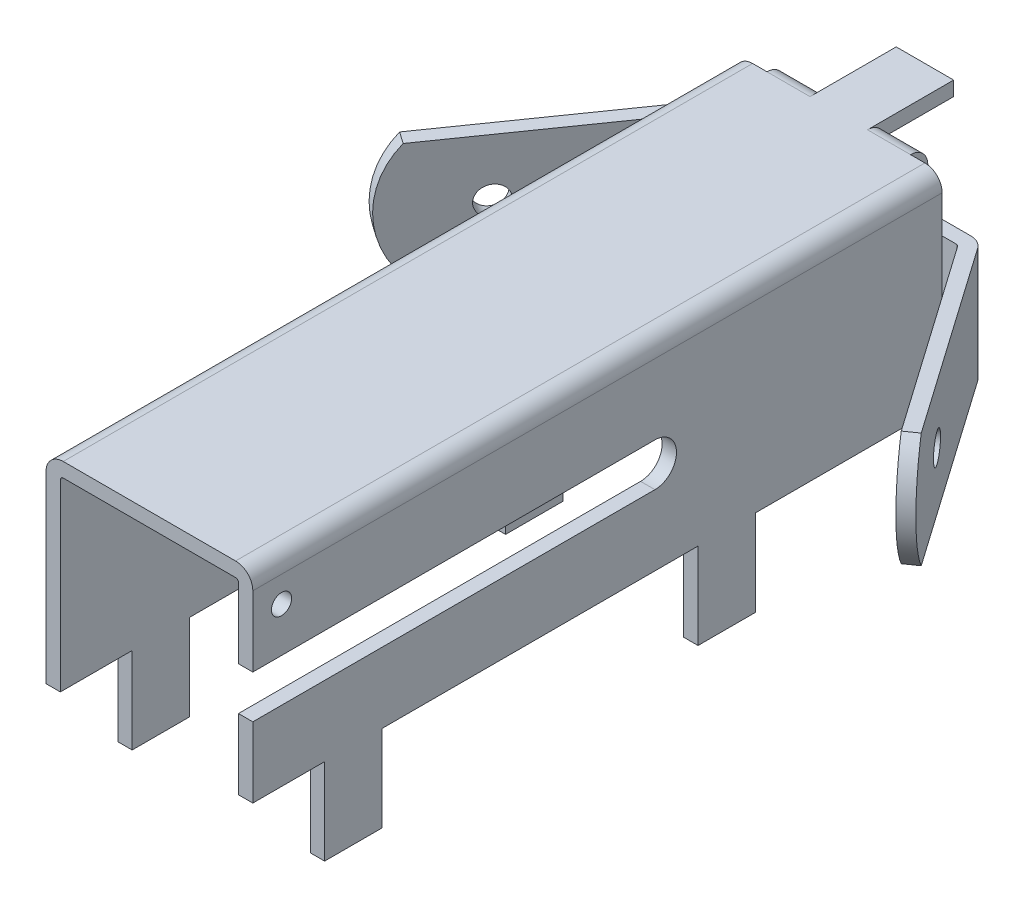
from build123d import *

# Parameters (mm, degrees)
BOSS_EXTRU_1_DEPTH      = 24
ESQUISSE2_W             = 2
ESQUISSE2_H             = 0.5
BOSS_EXTRU_2_DEPTH      = 3
BOSS_EXTRU_3_DEPTH      = 3
ESQUISSE6_W             = 0.6
ESQUISSE6_H             = 2
ENL_V_MAT_EXTRU_1_DEPTH = 1.5
BOSS_EXTRU_4_DEPTH      = 4
ENL_V_MAT_EXTRU_3_REACH = 29.975
ESQUISSE8_R             = 0.5
ESQUISSE9_W             = 0.5
ESQUISSE9_H             = 2
BOSS_EXTRU_5_DEPTH      = 3
ENL_V_MAT_EXTRU_2_REACH = 30.233
ESQUISSE7_R             = 0.35


with BuildPart() as part:
    # Esquisse1 → Boss.-Extru.1 (new body)
    with BuildSketch(Plane.XY):
        with BuildLine():
            Line((-3, 7), (3, 7))
            ThreePointArc((3, 7), (3.424264069, 6.824264069), (3.6, 6.4))
            Line((3.6, 6.4), (3.6, 0))
            Line((3.6, 0), (3.1, 0))
            Line((3.1, 0), (3.1, 6.4))
            ThreePointArc((3.1, 6.4), (3.070710678, 6.470710678), (3, 6.5))
            Line((3, 6.5), (-3, 6.5))
            ThreePointArc((-3, 6.5), (-3.070710678, 6.470710678), (-3.1, 6.4))
            Line((-3.1, 6.4), (-3.1, 0))
            Line((-3.1, 0), (-3.6, 0))
            Line((-3.6, 0), (-3.6, 6.4))
            ThreePointArc((-3.6, 6.4), (-3.424264069, 6.824264069), (-3, 7))
        make_face()
    extrude(amount=BOSS_EXTRU_1_DEPTH)

    # Esquisse2 → Boss.-Extru.2 (add)
    with BuildSketch(Plane(origin=(0, 0, 0), x_dir=(-1, 0, 0), z_dir=(0, 0, -1))):
        with Locations((0, 6.75)):
            Rectangle(ESQUISSE2_W, ESQUISSE2_H)
    extrude(amount=BOSS_EXTRU_2_DEPTH)

    # Esquisse5 → Boss.-Extru.3 (add)
    with BuildSketch(Plane.ZY.offset(1)):
        with BuildLine():
            Line((-0.1, 1), (-0.6, 1))
            Line((-0.6, 1), (-0.6, 6.4))
            ThreePointArc((-0.6, 6.4), (-0.424264069, 6.824264069), (0, 7))
            Line((0, 7), (0, 6.5))
            ThreePointArc((0, 6.5), (-0.070710678, 6.470710678), (-0.1, 6.4))
            Line((-0.1, 6.4), (-0.1, 1))
        make_face()
    boss_extru_3 = extrude(amount=BOSS_EXTRU_3_DEPTH)

    # Esquisse6 → Enlèv. mat.-Extru.1 (cut)
    with BuildSketch(Plane.ZY.offset(4)):
        with Locations((-0.3, 6)):
            Rectangle(ESQUISSE6_W, ESQUISSE6_H)
    enl_v_mat_extru_1 = extrude(amount=-ENL_V_MAT_EXTRU_1_DEPTH, mode=Mode.SUBTRACT)

    # Esquisse3 → Boss.-Extru.4 (add)
    with BuildSketch(Plane(origin=(0, 5, 0), x_dir=(1, 0, 0), z_dir=(0, 1, 0))):
        with BuildLine():
            Line((-4.491491227, 0.344145862), (-9.653679154, -7.028222537))
            Line((-9.653679154, -7.028222537), (-9.244103132, -7.315010755))
            Line((-9.244103132, -7.315010755), (-4.081915204, 0.057357644))
            ThreePointArc((-4.081915204, 0.057357644), (-4.046174861, 0.088701083), (-4, 0.1))
            Line((-4, 0.1), (-4, 0.6))
            ThreePointArc((-4, 0.6), (-4.277049168, 0.5322065), (-4.491491227, 0.344145862))
        make_face()
    boss_extru_4 = extrude(amount=-BOSS_EXTRU_4_DEPTH)

    # Esquisse8 → Enlèv. mat.-Extru.3 (cut, up to next)
    with BuildSketch(Plane(origin=(-3.175531513, 0, -2.223531103), x_dir=(-0.5735764363510417, 0, 0.8191520442889949), z_dir=(-0.819152044288995, 0, -0.5735764363510417)), mode=Mode.PRIVATE) as enl_v_mat_extru_3_sk1:
        with Locations((8.058237768, 3)):
            Circle(ESQUISSE8_R)
    enl_v_mat_extru_3_tool1 = extrude(enl_v_mat_extru_3_sk1.sketch, amount=-ENL_V_MAT_EXTRU_3_REACH, mode=Mode.PRIVATE) & part.part
    # Esquisse8 → Enlèv. mat.-Extru.3 (cut, up to next)
    with BuildSketch(Plane(origin=(-3.175531513, 0, -2.223531103), x_dir=(-0.5735764363510417, 0, 0.8191520442889949), z_dir=(-0.819152044288995, 0, -0.5735764363510417)), mode=Mode.PRIVATE) as enl_v_mat_extru_3_sk2:
        with BuildLine():
            Line((11.294305745, 1), (10.294305745, 1))
            ThreePointArc((10.294305745, 1), (11.058237768, 3), (10.294305745, 5))
            Line((10.294305745, 5), (11.294305745, 5))
            Line((11.294305745, 5), (11.294305745, 1))
        make_face()
    enl_v_mat_extru_3_tool2 = extrude(enl_v_mat_extru_3_sk2.sketch, amount=-ENL_V_MAT_EXTRU_3_REACH, mode=Mode.PRIVATE) & part.part
    enl_v_mat_extru_3_1 = enl_v_mat_extru_3_tool1.solids().sort_by_distance((-7.797547, 3, 4.377391))[0]
    add(enl_v_mat_extru_3_1, mode=Mode.SUBTRACT)
    enl_v_mat_extru_3_2 = enl_v_mat_extru_3_tool2.solids().sort_by_distance((-9.541925, 3, 6.868621))[0]
    add(enl_v_mat_extru_3_2, mode=Mode.SUBTRACT)
    enl_v_mat_extru_3 = enl_v_mat_extru_3_1 + enl_v_mat_extru_3_2  # Enlèv. mat.-Extru.3 as one shape, for the pattern or mirror that repeats it

    # Esquisse9 → Boss.-Extru.5 (add)
    with BuildSketch(Plane.XZ):
        with Locations((-3.35, 7.5)):
            Rectangle(ESQUISSE9_W, ESQUISSE9_H)
        with Locations((-3.35, 20.5)):
            Rectangle(ESQUISSE9_W, ESQUISSE9_H)
    boss_extru_5 = extrude(amount=BOSS_EXTRU_5_DEPTH)

    # Symétrie1: Boss.-Extru.3, Enlèv. mat.-Extru.1, Boss.-Extru.4, Enlèv. mat.-Extru.3, Boss.-Extru.5 across plane
    add(boss_extru_3.mirror(Plane(origin=(0, 0, 0), x_dir=(0, 0, 1), z_dir=(1, 0, 0))))
    add(enl_v_mat_extru_1.mirror(Plane(origin=(0, 0, 0), x_dir=(0, 0, 1), z_dir=(1, 0, 0))), mode=Mode.SUBTRACT)
    add(boss_extru_4.mirror(Plane(origin=(0, 0, 0), x_dir=(0, 0, 1), z_dir=(1, 0, 0))))
    add(enl_v_mat_extru_3.mirror(Plane(origin=(0, 0, 0), x_dir=(0, 0, 1), z_dir=(1, 0, 0))), mode=Mode.SUBTRACT)
    add(boss_extru_5.mirror(Plane(origin=(0, 0, 0), x_dir=(0, 0, 1), z_dir=(1, 0, 0))))

    # Esquisse7 → Enlèv. mat.-Extru.2 (cut, up to next)
    with BuildSketch(Plane(origin=(3.6, 0, 0), x_dir=(0, 0, -1), z_dir=(1, 0, 0)), mode=Mode.PRIVATE) as enl_v_mat_extru_2_sk1:
        with Locations((-23, 5.5)):
            Circle(ESQUISSE7_R)
    enl_v_mat_extru_2_tool1 = extrude(enl_v_mat_extru_2_sk1.sketch, amount=-ENL_V_MAT_EXTRU_2_REACH, mode=Mode.PRIVATE) & part.part
    # Esquisse7 → Enlèv. mat.-Extru.2 (cut, up to next)
    with BuildSketch(Plane(origin=(3.6, 0, 0), x_dir=(0, 0, -1), z_dir=(1, 0, 0)), mode=Mode.PRIVATE) as enl_v_mat_extru_2_sk2:
        with BuildLine():
            Line((-24, 3.95), (-10, 3.95))
            ThreePointArc((-10, 3.95), (-9.25, 3.2), (-10, 2.45))
            Line((-10, 2.45), (-24, 2.45))
            Line((-24, 2.45), (-24, 3.95))
        make_face()
    enl_v_mat_extru_2_tool2 = extrude(enl_v_mat_extru_2_sk2.sketch, amount=-ENL_V_MAT_EXTRU_2_REACH, mode=Mode.PRIVATE) & part.part
    add(enl_v_mat_extru_2_tool1.solids().sort_by_distance((3.6, 5.5, 23))[0], mode=Mode.SUBTRACT)
    add(enl_v_mat_extru_2_tool2.solids().sort_by_distance((3.6, 3.2, 16.704515))[0], mode=Mode.SUBTRACT)


solid = part.part
